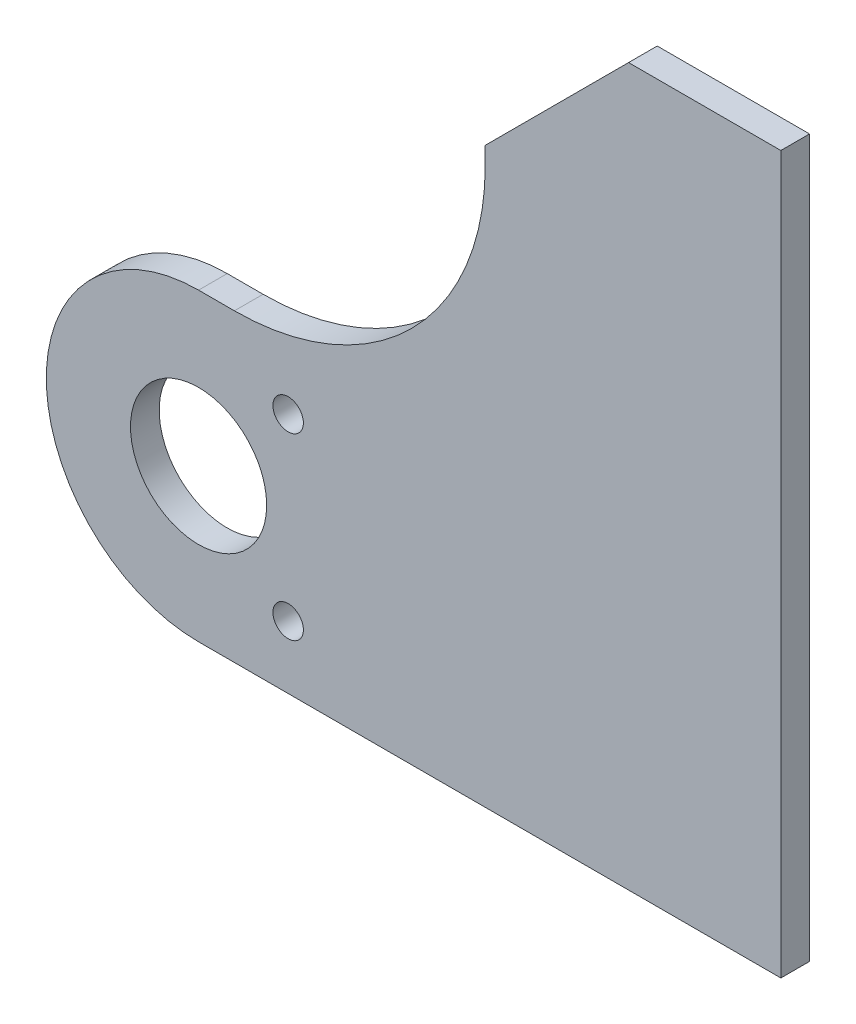
from build123d import *

# Parameters (mm, degrees)
SKIZZE1_R                       = 19
AUFSATZ_LINEAR_AUSTRAGEN1_DEPTH = 4
M10_GEWINDEBOHRUNG1_D           = 8.5


with BuildPart() as part:
    # Skizze1 → Aufsatz-Linear austragen1 (new, symmetric)
    with BuildSketch(Plane.XY):
        with BuildLine():
            Line((0, 42.5), (10, 42.5))
            ThreePointArc((10, 42.5), (59.497474683, 63.002525317), (80, 112.5))
            Line((80, 112.5), (80, 117.5))
            Line((80, 117.5), (120, 157.5))
            Line((120, 157.5), (162.5, 157.5))
            Line((162.5, 157.5), (162.5, -42.5))
            Line((162.5, -42.5), (0, -42.5))
            ThreePointArc((0, -42.5), (-42.5, 0), (0, 42.5))
        make_face()
        Circle(SKIZZE1_R, mode=Mode.SUBTRACT)
    extrude(amount=AUFSATZ_LINEAR_AUSTRAGEN1_DEPTH, both=True)

    # M10 Gewindebohrung1 (through all)
    with Locations(Plane.XY.offset(4)):
        with Locations((25, -25), (25, 25)):
            Hole(M10_GEWINDEBOHRUNG1_D / 2)


solid = part.part
